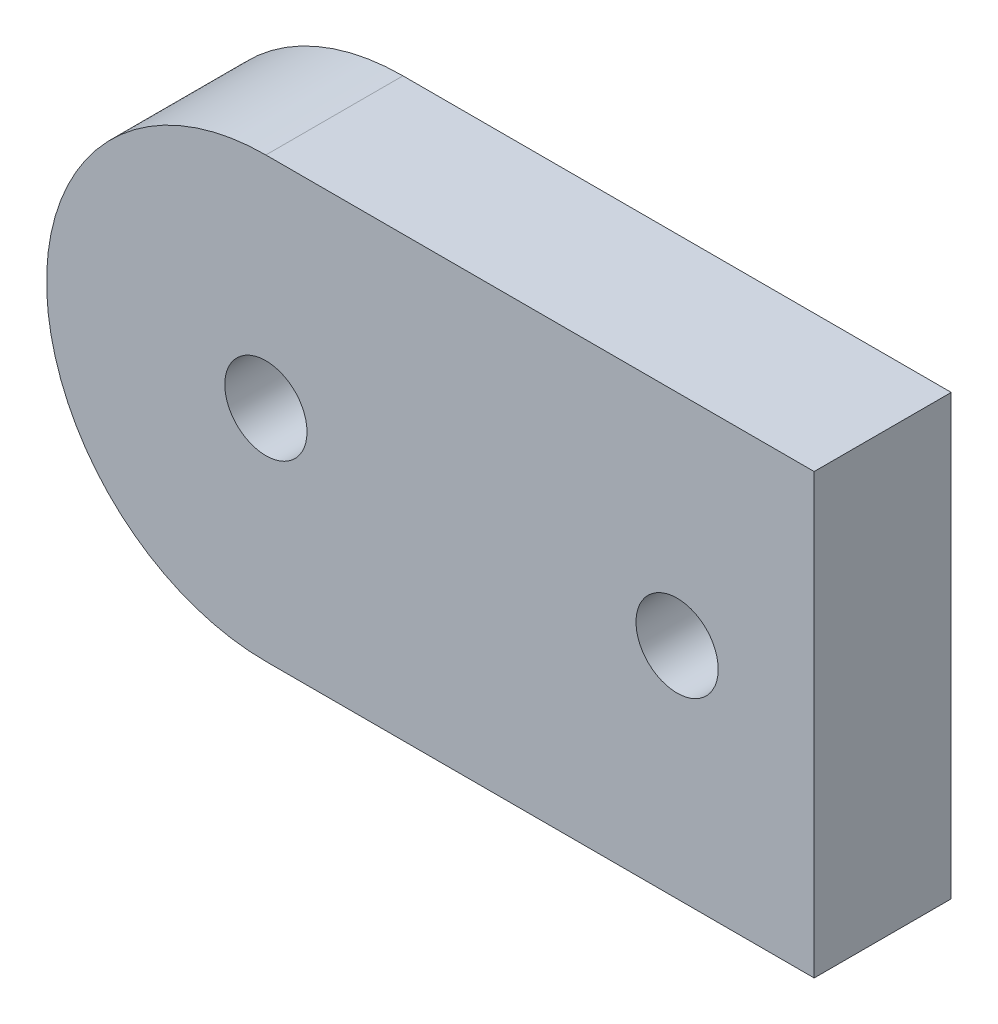
from build123d import *

# Parameters (mm, degrees)
ESQUISSE1_R        = 1.5
BOSS_EXTRU_1_DEPTH = 5


with BuildPart() as part:
    # Esquisse1 → Boss.-Extru.1 (new body)
    with BuildSketch(Plane.XY):
        with BuildLine():
            Line((0, 8), (20, 8))
            Line((20, 8), (20, -8))
            Line((20, -8), (0, -8))
            ThreePointArc((0, -8), (-8, 0), (0, 8))
        make_face()
        Circle(ESQUISSE1_R, mode=Mode.SUBTRACT)
        with Locations((15, 0)):
            Circle(ESQUISSE1_R, mode=Mode.SUBTRACT)
    extrude(amount=BOSS_EXTRU_1_DEPTH)


solid = part.part
